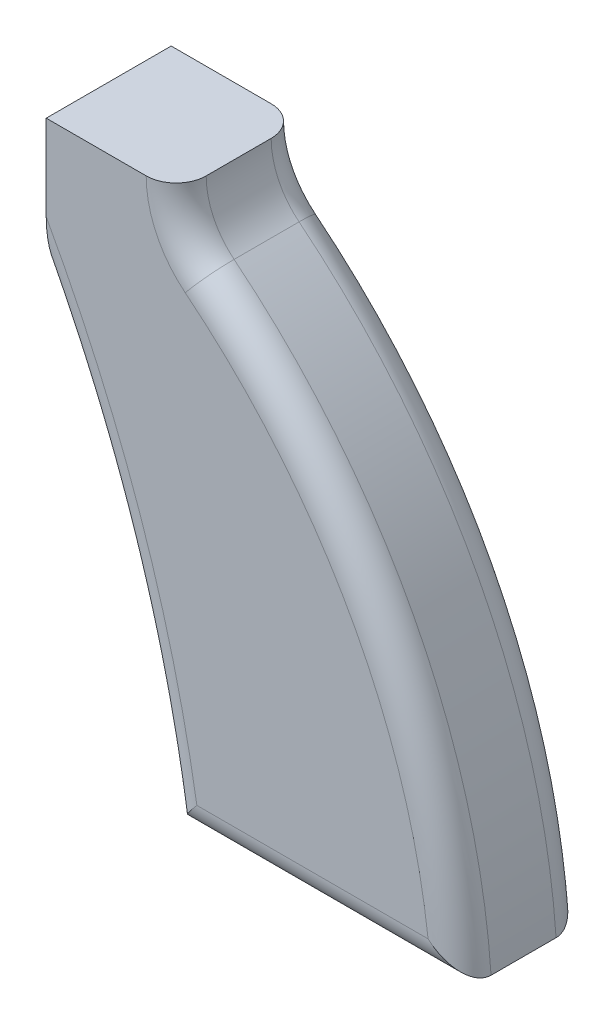
from build123d import *

# Parameters (mm, degrees)
EXTRUDE_1_DEPTH = 12.5
FILLET_1_R      = 6


with BuildPart() as part:
    # 草图1 → 凸台-拉伸1 (new, symmetric)
    with BuildSketch(Plane.XY):
        with BuildLine():
            Line((0, 0), (26, 0))
            ThreePointArc((26, 0), (27.468456661, -6.472815065), (31.586311315, -11.678290343))
            ThreePointArc((31.586311315, -11.678290343), (67.528745318, -55.48682347), (83, -110))
            Line((83, -110), (25, -110))
            ThreePointArc((25, -110), (15.68286649, -69.005354222), (0, -30))
            Line((0, -30), (0, 0))
        make_face()
    extrude(amount=EXTRUDE_1_DEPTH, both=True)

    # 圆角1
    fillet_1_edges = [part.edges().sort_by_distance(p)[0] for p in [
        (54, -110, 12.5),
        (67.528745318, -55.48682347, 12.5),
        (27.468456661, -6.472815065, 12.5),
        (27.468456661, -6.472815065, -12.5),
        (67.528745318, -55.48682347, -12.5),
        (54, -110, -12.5),
        (15.68286649, -69.005354222, -12.5),
        (15.68286649, -69.005354222, 12.5),
    ]]
    fillet(fillet_1_edges, radius=FILLET_1_R)


solid = part.part
